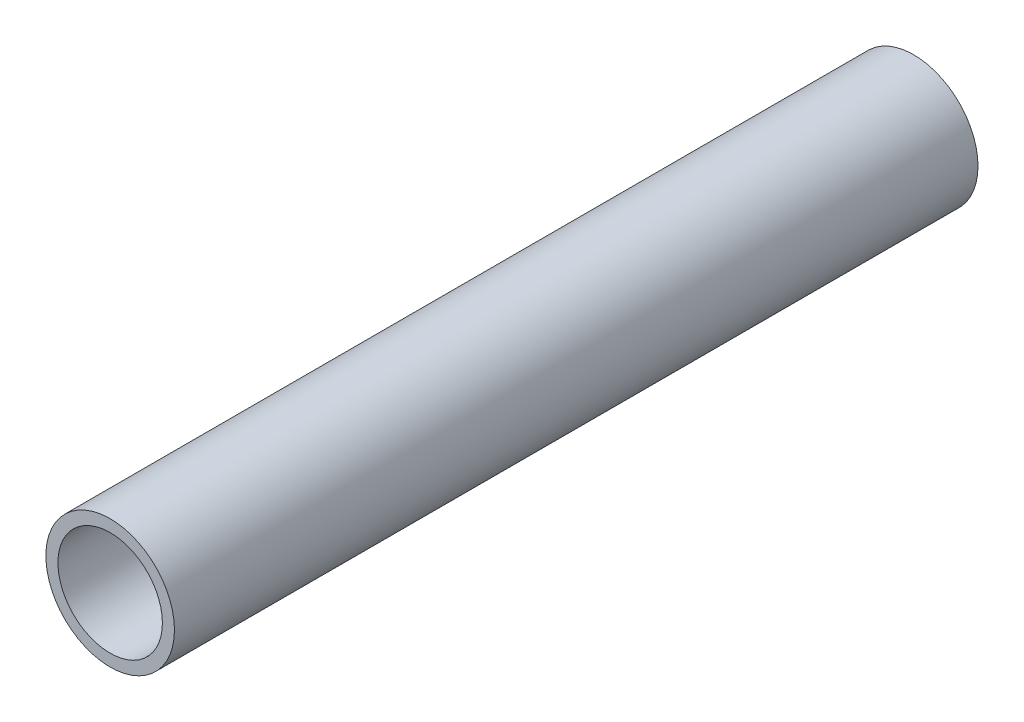
from build123d import *

# Parameters (mm, degrees)
SKETCH1_R           = 6.4
SKETCH1_R_2         = 5.2
BOSS_EXTRUDE1_DEPTH = 80


with BuildPart() as part:
    # Sketch1 → Boss-Extrude1 (new body)
    with BuildSketch(Plane.XY):
        Circle(SKETCH1_R)
        Circle(SKETCH1_R_2, mode=Mode.SUBTRACT)
    extrude(amount=BOSS_EXTRUDE1_DEPTH)


solid = part.part
